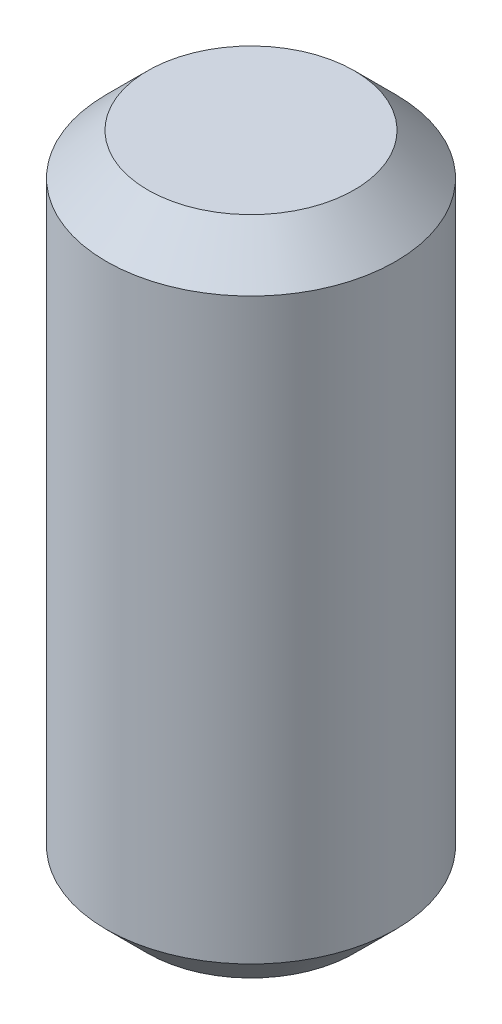
from build123d import *

# Parameters (mm, degrees)
SKETCH1_R           = 1.75
BOSS_EXTRUDE1_DEPTH = 8
CHAMFER1_SIZE       = 0.5


with BuildPart() as part:
    # Sketch1 → Boss-Extrude1 (new body)
    with BuildSketch(Plane(origin=(0, 0, 0), x_dir=(1, 0, 0), z_dir=(0, 1, 0))):
        with Locations(Location((0, 0, 0), (0, 0, 270))):
            Circle(SKETCH1_R)
    extrude(amount=-BOSS_EXTRUDE1_DEPTH)

    # Chamfer1
    chamfer1_edges = [part.edges().sort_by_distance(p)[0] for p in [
        (0, 0, -1.75),
        (0, -8, -1.75),
    ]]
    chamfer(chamfer1_edges, length=CHAMFER1_SIZE)


solid = part.part
